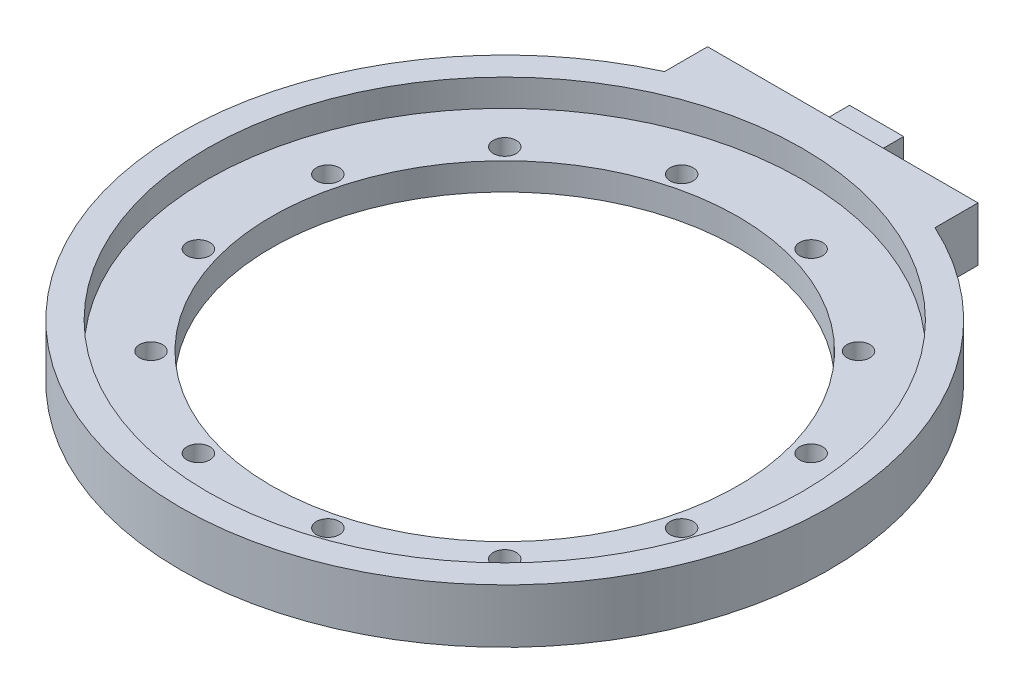
from build123d import *

# Parameters (mm, degrees)
SKETCH_1_R                   = 26.5
EXTRUDE_1_DEPTH              = 5
HOLE_WIZARD_M4_1_AT_2_COUNT  = 2
HOLE_WIZARD_M4_1_AT_2_PITCH  = 39.424388736
HOLE_WIZARD_M4_1_AT_3_COUNT  = 2
HOLE_WIZARD_M4_1_AT_3_PITCH  = 39.424388736
HOLE_WIZARD_M4_1_AT_4_COUNT  = 2
HOLE_WIZARD_M4_1_AT_4_PITCH  = 18.383894388
HOLE_WIZARD_M4_1_AT_5_COUNT  = 2
HOLE_WIZARD_M4_1_AT_5_PITCH  = 43.5
HOLE_WIZARD_M4_1_AT_6_COUNT  = 2
HOLE_WIZARD_M4_1_AT_6_PITCH  = 39.424388736
HOLE_WIZARD_M4_1_AT_7_COUNT  = 2
HOLE_WIZARD_M4_1_AT_7_PITCH  = 18.383894388
EXTRUDE_1604_DEPTH           = 8
SKETCH_8_R                   = 34.5
CUT_EXTRUDE_1696_DEPTH       = 119.962346984
HOLE_WIZARD_M3_1_D           = 3.4
HOLE_WIZARD_M3_1_CBORE_D     = 6.5
HOLE_WIZARD_M3_1_CBORE_DEPTH = 3
SKETCH_11_R                  = 26.5
CUT_EXTRUDE_1_DEPTH          = 5
SKETCH_12_R                  = 44
CUT_EXTRUDE_6_DEPTH          = 4


with BuildPart() as part:
    # 草图1 → 凸台-拉伸1 (new body)
    with BuildSketch(Plane.XY):
        Circle(SKETCH_1_R)
    extrude(amount=EXTRUDE_1_DEPTH)

    # 草图3 → M4 六角凹头盖的柱孔1 (revolve, cut)
    with BuildSketch(Plane(origin=(21.75, 0, 5), x_dir=(0, -1, 0), z_dir=(1, 0, 0))):
        Polygon((0, 0), (0, 5), (2.25, 5), (2.25, 4), (4, 4), (4, 0), align=None)
    hole_wizard_m4_1 = revolve(axis=Axis((21.75, 0, 11.35), (0, 0, -1)), mode=Mode.SUBTRACT)

    # M4 六角凹头盖的柱孔1 at 2: M4 六角凹头盖的柱孔1 ×2
    with Locations(*[Vector(-0.9063077870366496, 0.4226182617407002, 0) * (i * HOLE_WIZARD_M4_1_AT_2_PITCH) for i in range(1, HOLE_WIZARD_M4_1_AT_2_COUNT)]):
        add(hole_wizard_m4_1, mode=Mode.SUBTRACT)

    # M4 六角凹头盖的柱孔1 at 3: M4 六角凹头盖的柱孔1 ×2
    with Locations(*[Vector(-0.9063077870125524, 0.42261826179237694, 0) * (i * HOLE_WIZARD_M4_1_AT_3_PITCH) for i in range(1, HOLE_WIZARD_M4_1_AT_3_COUNT)]):
        add(hole_wizard_m4_1, mode=Mode.SUBTRACT)

    # M4 六角凹头盖的柱孔1 at 4: M4 六角凹头盖的柱孔1 ×2
    with Locations(*[Vector(-0.42261826172613215, 0.9063077870434428, 0) * (i * HOLE_WIZARD_M4_1_AT_4_PITCH) for i in range(1, HOLE_WIZARD_M4_1_AT_4_COUNT)]):
        add(hole_wizard_m4_1, mode=Mode.SUBTRACT)

    # M4 六角凹头盖的柱孔1 at 5: M4 六角凹头盖的柱孔1 ×2
    with Locations(*[(-i * HOLE_WIZARD_M4_1_AT_5_PITCH, 0, 0) for i in range(1, HOLE_WIZARD_M4_1_AT_5_COUNT)]):
        add(hole_wizard_m4_1, mode=Mode.SUBTRACT)

    # M4 六角凹头盖的柱孔1 at 6: M4 六角凹头盖的柱孔1 ×2
    with Locations(*[Vector(-0.9063077870125524, -0.42261826179237694, 0) * (i * HOLE_WIZARD_M4_1_AT_6_PITCH) for i in range(1, HOLE_WIZARD_M4_1_AT_6_COUNT)]):
        add(hole_wizard_m4_1, mode=Mode.SUBTRACT)

    # M4 六角凹头盖的柱孔1 at 7: M4 六角凹头盖的柱孔1 ×2
    with Locations(*[Vector(-0.42261826172613215, -0.9063077870434428, 0) * (i * HOLE_WIZARD_M4_1_AT_7_PITCH) for i in range(1, HOLE_WIZARD_M4_1_AT_7_COUNT)]):
        add(hole_wizard_m4_1, mode=Mode.SUBTRACT)

    # 草图5 → Extrude 1604 (add)
    with BuildSketch(Plane.XZ.offset(-8.7)):
        with BuildLine():
            Line((-20, 5), (-20, 11.365151541))
            ThreePointArc((-20, 11.365151541), (0, 103), (20, 11.365151541))
            Line((20, 11.365151541), (20, 5))
            Line((20, 5), (-20, 5))
        make_face()
    extrude(amount=-EXTRUDE_1604_DEPTH)

    # 草图8 → Cut-Extrude 1696 (cut, through all)
    with BuildSketch(Plane.XZ.offset(-8.7)):
        with Locations(Location((0, 55, 0), (0, 0, 270))):
            Circle(SKETCH_8_R)
    extrude(amount=-CUT_EXTRUDE_1696_DEPTH, mode=Mode.SUBTRACT)

    # M3 六角凹头盖的柱孔1 (through all)
    with Locations(Plane(origin=(-9.576304669, 16.7, 19.260744427), x_dir=(0, 0, 1), z_dir=(0, 1, 0))):
        with Locations((0, 0), (0, 19.152609338), (9.576304669, 35.739255573), (26.162950904, 45.315560242), (45.315560242, 45.315560242), (62.358629164, 36.19567826), (71.478511143, 19.152609339), (71.478511146, 0), (61.902206477, -16.586646235), (9.576304669, -16.586646235), (26.162950904, -26.162950904), (45.315560242, -26.162950904)):
            CounterBoreHole(HOLE_WIZARD_M3_1_D / 2, HOLE_WIZARD_M3_1_CBORE_D / 2, HOLE_WIZARD_M3_1_CBORE_DEPTH)

    # 草图11 → 切除-拉伸1 (cut)
    with BuildSketch(Plane.XY):
        Circle(SKETCH_11_R)
        Polygon((-4, 14.7), (4, 14.7), (4, 11.7), (12, 11.7), (12, 8.7), (-12, 8.7), (-12, 11.7), (-4, 11.7), align=None, mode=Mode.SUBTRACT)
    extrude(amount=CUT_EXTRUDE_1_DEPTH, mode=Mode.SUBTRACT)

    # 草图12 → 切除-拉伸6 (cut)
    with BuildSketch(Plane(origin=(0, 16.7, 0), x_dir=(1, 0, 0), z_dir=(0, 1, 0))):
        with Locations(Location((0, -55, 0), (0, 0, 270))):
            Circle(SKETCH_12_R)
    extrude(amount=-CUT_EXTRUDE_6_DEPTH, mode=Mode.SUBTRACT)


solid = part.part
